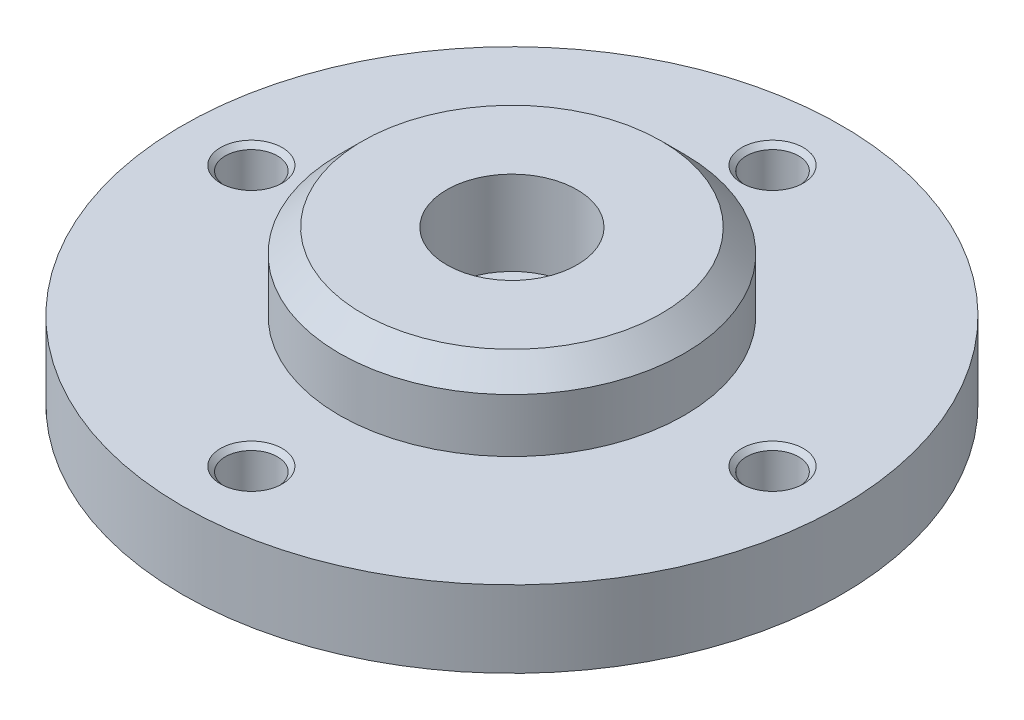
from build123d import *

# Parameters (mm, degrees)
SKETCH3_R                   = 2.5
CUT_EXTRUDE1_DEPTH          = 10
CHAMFER1_SIZE               = 3
M8_TAPPED_HOLE1_D           = 6.8
M8_TAPPED_HOLE1_DEPTH       = 19.75
M8_TAPPED_HOLE1_CSINK_D     = 8.05
M8_TAPPED_HOLE1_CSINK_ANGLE = 90
M8_TAPPED_HOLE1_TIP         = 2.042926105


with BuildPart() as part:
    # Sketch1 → Revolve1 (revolve)
    with BuildSketch(Plane.XY, mode=Mode.PRIVATE) as revolve1_sk:
        Polygon((43, 0), (43, 10), (22.5, 10), (22.5, 20), (8.5, 20), (8.5, 9), (5, 9), (5, 3), (25, 3), (25, 0), align=None)
    revolve(revolve1_sk.sketch.rotate(Axis((0, 0, 0), (0, -1, 0)), 90), axis=Axis((0, 0, 0), (0, -1, 0)))

    # Sketch3 → Cut-Extrude1 (cut)
    with BuildSketch(Plane(origin=(0, 10, 0), x_dir=(1, 0, 0), z_dir=(0, 1, 0))):
        with Locations(Location((34, 0, 0), (0, 0, 270))):
            Circle(SKETCH3_R)
        with Locations(Location((0, -34, 0), (0, 0, 270))):
            Circle(SKETCH3_R)
        with Locations(Location((-34, 0, 0), (0, 0, 270))):
            Circle(SKETCH3_R)
        with Locations(Location((0, 34, 0), (0, 0, 270))):
            Circle(SKETCH3_R)
    extrude(amount=-CUT_EXTRUDE1_DEPTH, mode=Mode.SUBTRACT)

    # Chamfer1
    chamfer1_edges = [part.edges().sort_by_distance(p)[0] for p in [
        (0, 20, -22.5),
    ]]
    chamfer(chamfer1_edges, length=CHAMFER1_SIZE)

    # M8 Tapped Hole1
    with Locations(Plane(origin=(0, 10, -34), x_dir=(0, 0, 1), z_dir=(0, 1, 0))):
        with Locations((0, 0), (34, 34), (68, 0), (34, -34)):
            CounterSinkHole(M8_TAPPED_HOLE1_D / 2, M8_TAPPED_HOLE1_CSINK_D / 2, depth=M8_TAPPED_HOLE1_DEPTH, counter_sink_angle=M8_TAPPED_HOLE1_CSINK_ANGLE)
            with Locations((0, 0, -(M8_TAPPED_HOLE1_DEPTH + M8_TAPPED_HOLE1_TIP / 2))):  # 118° drill point
                Cone(0, M8_TAPPED_HOLE1_D / 2, M8_TAPPED_HOLE1_TIP, mode=Mode.SUBTRACT)


solid = part.part
